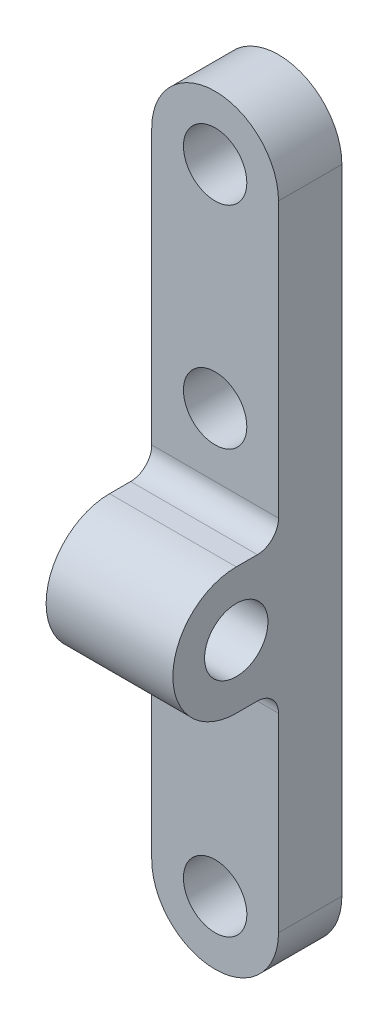
from build123d import *

# Parameters (mm, degrees)
SKETCH_1_R          = 1.5
EXTRUDE_1_DEPTH     = 3
SKETCH_2_R          = 1.5
EXTRUDE_4_DEPTH     = 6
FILLET_1_R          = 1
SKETCH_3_R          = 1.5
CUT_EXTRUDE_1_DEPTH = 10


with BuildPart() as part:
    # ｽｹｯﾁ1 → ﾎﾞｽ - 押し出し1 (new body)
    with BuildSketch(Plane.XY):
        with BuildLine():
            Line((-3, 0), (-3, -30))
            ThreePointArc((-3, -30), (0, -33), (3, -30))
            Line((3, -30), (3, 0))
            ThreePointArc((3, 0), (0, 3), (-3, 0))
        make_face()
        Circle(SKETCH_1_R, mode=Mode.SUBTRACT)
        with Locations(Location((0, -30, 0), (0, 0, 180))):
            Circle(SKETCH_1_R, mode=Mode.SUBTRACT)
    extrude(amount=EXTRUDE_1_DEPTH)

    # ｽｹｯﾁ2 → ﾎﾞｽ - 押し出し4 (add)
    with BuildSketch(Plane(origin=(3, 0, 0), x_dir=(0, 0, -1), z_dir=(1, 0, 0))):
        with BuildLine():
            Line((0, -14), (-5, -14))
            ThreePointArc((-5, -14), (-8, -17), (-5, -20))
            Line((-5, -20), (0, -20))
            Line((0, -20), (0, -14))
        make_face()
        with Locations(Location((-5, -17, 0), (0, 0, 90))):
            Circle(SKETCH_2_R, mode=Mode.SUBTRACT)
    extrude(amount=-EXTRUDE_4_DEPTH)

    # ﾌｨﾚｯﾄ1
    fillet_1_edges = [part.edges().sort_by_distance(p)[0] for p in [
        (0, -14, 3),
        (0, -20, 3),
    ]]
    fillet(fillet_1_edges, radius=FILLET_1_R)

    # ｽｹｯﾁ3 → ｶｯﾄ - 押し出し1 (cut)
    with BuildSketch(Plane(origin=(0, 0, 0), x_dir=(-1, 0, 0), z_dir=(0, 0, -1))):
        with Locations((0, -10)):
            Circle(SKETCH_3_R)
    extrude(amount=-CUT_EXTRUDE_1_DEPTH, mode=Mode.SUBTRACT)


solid = part.part
